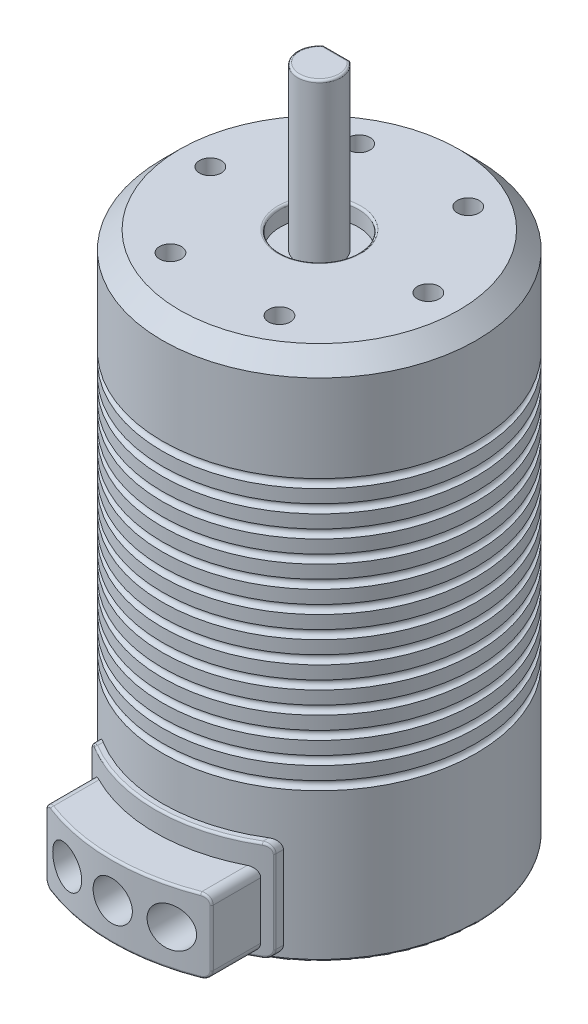
from build123d import *

# Parameters (mm, degrees)
SKETCH1_W                = 13.5
SKETCH1_H                = 60
SKETCH2_R                = 0.5
BOSS_EXTRUDE1_START      = -2
SKETCH3_R                = 4.5
SKETCH3_R_2              = 2.5
BOSS_EXTRUDE1_DEPTH      = 56
BOSS_EXTRUDE2_DEPTH      = 16.6
BOSS_EXTRUDE2_DEPTH_BACK = 58.7
SKETCH3_2_R              = 2.5
CUT_EXTRUDE1_DEPTH       = 15
CHAMFER1_SIZE            = 2
BOSS_EXTRUDE3_START      = -0.5
BOSS_EXTRUDE3_DEPTH      = 11.5
BOSS_EXTRUDE4_START      = -1
BOSS_EXTRUDE4_DEPTH      = 8.5
SKETCH6_R                = 2.25
CUT_EXTRUDE2_DEPTH       = 12.5
FILLET1_R                = 1
FILLET2_R                = 0.25
SKETCH7_R                = 1.25
CUT_EXTRUDE3_DEPTH       = 6


with BuildPart() as part:
    # Sketch1 → Revolve1 (revolve)
    with BuildSketch(Plane.XY, mode=Mode.PRIVATE) as revolve1_sk:
        with Locations((11.25, -30)):
            Rectangle(SKETCH1_W, SKETCH1_H)
    revolve(revolve1_sk.sketch.rotate(Axis((0, 0, 0), (0, -1, 0)), 90), axis=Axis((0, 0, 0), (0, -1, 0)))

    # Sketch2 → Cut-Revolve1 (revolve, cut)
    with BuildSketch(Plane.XY, mode=Mode.PRIVATE) as cut_revolve1_sk:
        with Locations((18, -12.5)):
            Circle(SKETCH2_R)
        with Locations((18, -15)):
            Circle(SKETCH2_R)
        with Locations((18, -17.5)):
            Circle(SKETCH2_R)
        with Locations((18, -20)):
            Circle(SKETCH2_R)
        with Locations((18, -22.5)):
            Circle(SKETCH2_R)
        with Locations((18, -25)):
            Circle(SKETCH2_R)
        with Locations((18, -27.5)):
            Circle(SKETCH2_R)
        with Locations((18, -30)):
            Circle(SKETCH2_R)
        with Locations((18, -32.5)):
            Circle(SKETCH2_R)
        with Locations((18, -35)):
            Circle(SKETCH2_R)
        with Locations((18, -37.5)):
            Circle(SKETCH2_R)
        with Locations((18, -40)):
            Circle(SKETCH2_R)
        with Locations((18, -42.5)):
            Circle(SKETCH2_R)
    revolve(cut_revolve1_sk.sketch.rotate(Axis((0, 0, 0), (0, -1, 0)), 90), axis=Axis((0, 0, 0), (0, -1, 0)), mode=Mode.SUBTRACT)

    # Sketch3 → Boss-Extrude1 (add)
    with BuildSketch(Plane(origin=(0, 0, 0), x_dir=(1, 0, 0), z_dir=(0, 1, 0)).offset(BOSS_EXTRUDE1_START)):
        with Locations(Location((0, 0, 0), (0, 0, 270))):
            Circle(SKETCH3_R)
        with Locations(Location((0, 0, 0), (0, 0, 270))):
            Circle(SKETCH3_R_2, mode=Mode.SUBTRACT)
    extrude(amount=-BOSS_EXTRUDE1_DEPTH)

    # Sketch3<2> → Boss-Extrude2 (add, two sides: drawn at the far end of the back side and taken through both)
    with BuildSketch(Plane(origin=(0, 0, 0), x_dir=(1, 0, 0), z_dir=(0, 1, 0)).offset(-BOSS_EXTRUDE2_DEPTH_BACK)):
        with Locations(Location((0, 0, 0), (0, 0, 270))):
            Circle(SKETCH3_2_R)
    extrude(amount=BOSS_EXTRUDE2_DEPTH + BOSS_EXTRUDE2_DEPTH_BACK)

    # Sketch4 → Cut-Extrude1 (cut)
    with BuildSketch(Plane(origin=(0, 16.6, 0), x_dir=(1, 0, 0), z_dir=(0, 1, 0))):
        with BuildLine():
            Line((-1.5, 2), (1.5, 2))
            ThreePointArc((1.5, 2), (0, 2.5), (-1.5, 2))
        make_face()
    extrude(amount=-CUT_EXTRUDE1_DEPTH, mode=Mode.SUBTRACT)

    # Chamfer1
    chamfer1_edges = [part.edges().sort_by_distance(p)[0] for p in [
        (0, 0, -18),
    ]]
    chamfer(chamfer1_edges, length=CHAMFER1_SIZE)

    # Sketch5 → Boss-Extrude3 (add)
    with BuildSketch(Plane.XZ.offset(60).offset(BOSS_EXTRUDE3_START)):
        with BuildLine():
            ThreePointArc((-9.5, 16.223131634), (-10.004937712, 15.916696309), (-10.5, 15.59455033))
            Line((-10.5, 15.59455033), (-10.5, 14.620191517))
            ThreePointArc((-10.5, 14.620191517), (-10.005587824, 14.962894516), (-9.5, 15.288884851))
            Line((-9.5, 15.288884851), (-9.5, 16.223131634))
        make_face()
        with BuildLine():
            ThreePointArc((9.5, 16.223131634), (0, 18.8), (-9.5, 16.223131634))
            Line((-9.5, 16.223131634), (-9.5, 15.288884851))
            ThreePointArc((-9.5, 15.288884851), (0, 18), (9.5, 15.288884851))
            Line((9.5, 15.288884851), (9.5, 16.223131634))
        make_face()
        with BuildLine():
            ThreePointArc((9.5, 15.288884851), (10.005587824, 14.962894516), (10.5, 14.620191517))
            Line((10.5, 14.620191517), (10.5, 15.59455033))
            ThreePointArc((10.5, 15.59455033), (10.004937712, 15.916696309), (9.5, 16.223131634))
            Line((9.5, 16.223131634), (9.5, 15.288884851))
        make_face()
    extrude(amount=-BOSS_EXTRUDE3_DEPTH)

    # Sketch5<4> → Boss-Extrude4 (add)
    with BuildSketch(Plane.XZ.offset(60).offset(BOSS_EXTRUDE4_START)):
        with BuildLine():
            Line((-9.5, 21.821778113), (-9.5, 16.223131634))
            ThreePointArc((-9.5, 16.223131634), (0, 18.8), (9.5, 16.223131634))
            Line((9.5, 16.223131634), (9.5, 21.821778113))
            ThreePointArc((9.5, 21.821778113), (0, 23.8), (-9.5, 21.821778113))
        make_face()
    extrude(amount=-BOSS_EXTRUDE4_DEPTH)

    # Sketch6 → Cut-Extrude2 (cut)
    with BuildSketch(Plane.XY.offset(23.8)):
        with Locations((0, -54.75)):
            Circle(SKETCH6_R)
        with Locations((6, -54.75)):
            Circle(SKETCH6_R)
        with Locations((-6, -54.75)):
            Circle(SKETCH6_R)
    extrude(amount=-CUT_EXTRUDE2_DEPTH, mode=Mode.SUBTRACT)

    # Fillet1
    fillet1_edges = [part.edges().sort_by_distance(p)[0] for p in [
        (9.5, -59, 19.022454873),
        (-9.5, -59, 19.022454873),
        (-10.5, -48, 15.107370924),
        (10.5, -48, 15.107370924),
        (10.5, -59.5, 15.107370924),
        (-10.5, -59.5, 15.107370924),
        (9.5, -50.5, 19.022454873),
        (-9.5, -50.5, 19.022454873),
    ]]
    fillet(fillet1_edges, radius=FILLET1_R)

    # Fillet2
    fillet2_edges = [part.edges().sort_by_distance(p)[0] for p in [
        (0, -59.5, 18.8),
        (10.5, -53.75, 15.59455033),
        (0, -48, 18.8),
        (-10.5, -53.75, 15.59455033),
        (-10.179962223, -48.26675279, 15.805327278),
        (-10.179962181, -59.233247183, 15.805327265),
        (10.179962181, -48.266752817, 15.805327265),
        (10.179962181, -59.233247183, 15.805327265),
        (9.5, -54.75, 21.821778113),
        (0, -59, 23.8),
        (0, -50.5, 23.8),
        (-9.5, -54.75, 21.821778113),
        (-9.194450711, -58.719540275, 21.952268132),
        (-9.194450714, -50.780459721, 21.952268131),
        (9.194450688, -58.719540303, 21.952268142),
        (9.194450688, -50.780459697, 21.952268142),
        (0, 0, -4.5),
        (0, -60, -18),
        (0, -60, -4.5),
        (2.371708245, 16.6, 0.790569415),
        (0, 16.6, -2),
    ]]
    fillet(fillet2_edges, radius=FILLET2_R)

    # Sketch7 → Cut-Extrude3 (cut)
    with BuildSketch(Plane(origin=(0, 0, 0), x_dir=(1, 0, 0), z_dir=(0, 1, 0))):
        with Locations(Location((-6.25, 10.825317547, 0), (0, 0, 270))):
            Circle(SKETCH7_R)
        with Locations(Location((6.25, 10.825317547, 0), (0, 0, 270))):
            Circle(SKETCH7_R)
        with Locations(Location((12.5, 0, 0), (0, 0, 270))):
            Circle(SKETCH7_R)
        with Locations(Location((6.25, -10.825317547, 0), (0, 0, 270))):
            Circle(SKETCH7_R)
        with Locations(Location((-6.25, -10.825317547, 0), (0, 0, 270))):
            Circle(SKETCH7_R)
        with Locations(Location((-12.5, 0, 0), (0, 0, 270))):
            Circle(SKETCH7_R)
    extrude(amount=-CUT_EXTRUDE3_DEPTH, mode=Mode.SUBTRACT)


solid = part.part
